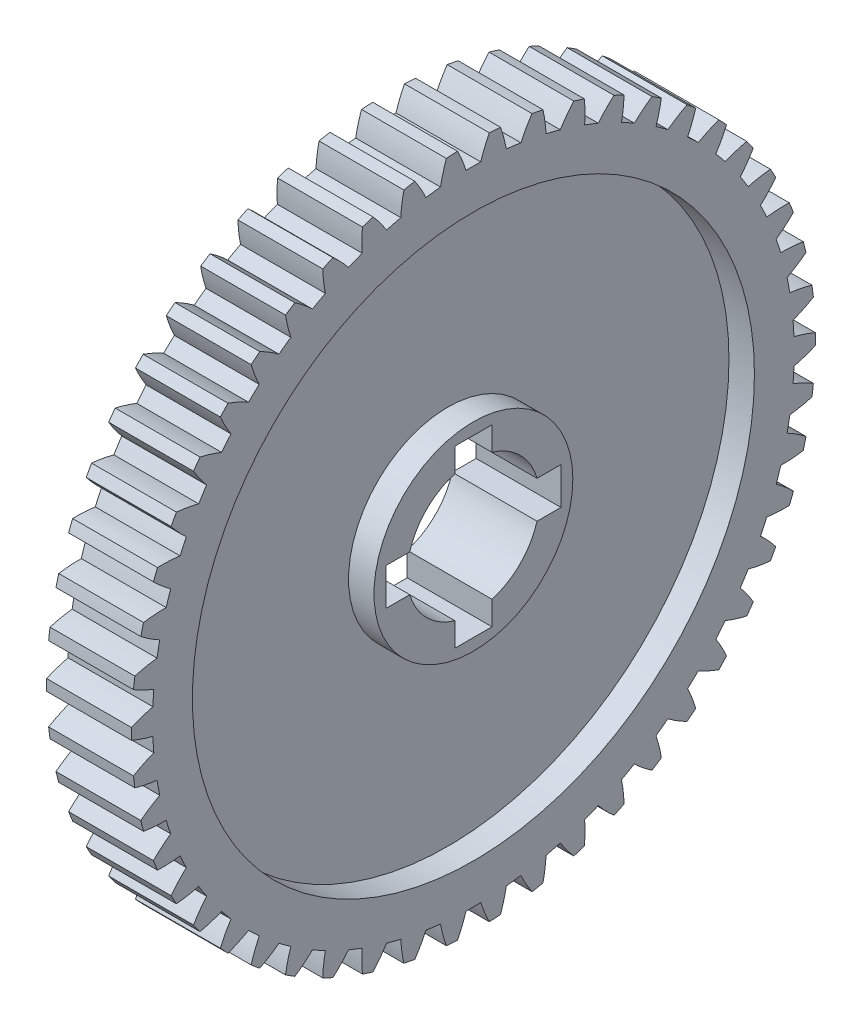
from build123d import *

# Parameters (mm, degrees)
BASPROSKE_W        = 16
BASPROSKE_H        = 64.5
TOOTHCUT_DEPTH     = 93.609394772
TEETHCUTS_COUNT    = 50
TEETHCUTS_ANGLE    = 352.8
BORSKE_R           = 12.5
BORE_DEPTH         = 50.0000508
SKETCH1_R          = 52.999
SKETCH1_R_2        = 18.75
CUT_EXTRUDE1_DEPTH = 4.8
CUT_EXTRUDE2_START = -4.8
SKETCH2_R          = 52.999
SKETCH2_R_2        = 18.75
CUT_EXTRUDE2_DEPTH = 4.8
SKETCH3_W          = 7
SKETCH3_H          = 8
SKETCH3_W_2        = 8
SKETCH3_H_2        = 7
CUT_EXTRUDE4_DEPTH = 93.56072603


with BuildPart() as part:
    # BasProSke → Base-Revolve (revolve)
    with BuildSketch(Plane(origin=(0, 0, 0), x_dir=(1, 0, 0), z_dir=(0, 1, 0)), mode=Mode.PRIVATE) as base_revolve_sk:
        with Locations((8, 32.25)):
            Rectangle(BASPROSKE_W, BASPROSKE_H)
    revolve(base_revolve_sk.sketch.rotate(Axis((-10, 0, 0), (1, 0, 0)), 180), axis=Axis((-10, 0, 0), (1, 0, 0)))

    # TooCutSke → ToothCut (cut, through all)
    with BuildSketch(Plane(origin=(0, 0, 0), x_dir=(0, 0, -1), z_dir=(1, 0, 0))):
        with BuildLine():
            ThreePointArc((1.387484143, 60.483087626), (0, 60.499), (-1.387484143, 60.483087626))
            ThreePointArc((-1.387484143, 60.483087626), (-2.115716053, 62.50399873), (-3.01474543, 64.454934296))
            ThreePointArc((-3.01474543, 64.454934296), (0, 64.5254), (3.01474543, 64.454934296))
            ThreePointArc((3.01474543, 64.454934296), (2.115716053, 62.50399873), (1.387484143, 60.483087626))
        make_face()
    toothcut = extrude(amount=TOOTHCUT_DEPTH, mode=Mode.SUBTRACT)

    # TeethCuts: ToothCut ×50 about axis
    teethcuts_axis = Axis((-10, 0, 0), (1, 0, 0))
    for i in range(1, TEETHCUTS_COUNT):
        add(toothcut.rotate(teethcuts_axis, i * TEETHCUTS_ANGLE / (TEETHCUTS_COUNT - 1)), mode=Mode.SUBTRACT)

    # BorSke → Bore (cut, symmetric)
    with BuildSketch(Plane(origin=(0, 0, 0), x_dir=(0, 0, -1), z_dir=(1, 0, 0))):
        with Locations(Location((0, 0, 0), (0, 0, 180))):
            Circle(BORSKE_R)
    extrude(amount=BORE_DEPTH, both=True, mode=Mode.SUBTRACT)

    # Sketch1 → Cut-Extrude1 (cut)
    with BuildSketch(Plane(origin=(16, 0, 0), x_dir=(0, 0, -1), z_dir=(1, 0, 0))):
        Circle(SKETCH1_R)
        Circle(SKETCH1_R_2, mode=Mode.SUBTRACT)
    extrude(amount=-CUT_EXTRUDE1_DEPTH, mode=Mode.SUBTRACT)

    # Sketch2 → Cut-Extrude2 (cut)
    with BuildSketch(Plane.ZY.offset(CUT_EXTRUDE2_START)):
        with Locations(Location((0, 0, 0), (0, 0, 180))):
            Circle(SKETCH2_R)
        with Locations(Location((0, 0, 0), (0, 0, 180))):
            Circle(SKETCH2_R_2, mode=Mode.SUBTRACT)
    extrude(amount=CUT_EXTRUDE2_DEPTH, mode=Mode.SUBTRACT)

    # Sketch3 → Cut-Extrude4 (cut, through all)
    with BuildSketch(Plane(origin=(16, 0, 0), x_dir=(0, 0, -1), z_dir=(1, 0, 0))):
        with Locations((0, 12.5)):
            Rectangle(SKETCH3_W, SKETCH3_H)
        with Locations((0, -12.5)):
            Rectangle(SKETCH3_W, SKETCH3_H)
        with Locations((-12.5, 0)):
            Rectangle(SKETCH3_W_2, SKETCH3_H_2)
        with Locations((12.5, 0)):
            Rectangle(SKETCH3_W_2, SKETCH3_H_2)
    extrude(amount=-CUT_EXTRUDE4_DEPTH, mode=Mode.SUBTRACT)


solid = part.part
